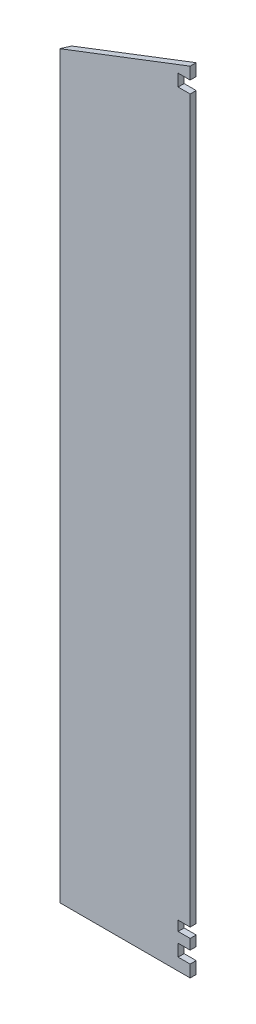
from build123d import *

# Parameters (mm, degrees)
BOSS_EXTRUDE1_DEPTH = 16
CUT_EXTRUDE2_DEPTH  = 2104.387610499
SKETCH6_W           = 32
SKETCH6_H           = 32
SKETCH6_H_2         = 26
CUT_EXTRUDE4_DEPTH  = 1063.402282565


with BuildPart() as part:
    # Sketch1 → Boss-Extrude1 (new body)
    with BuildSketch(Plane.XY):
        Polygon((173, 1048.1), (-173, 915.283043878), (-173, -1048.1), (173, -1048.1), align=None)
    extrude(amount=BOSS_EXTRUDE1_DEPTH)

    # Sketch3 → Cut-Extrude2 (cut, through all)
    with BuildSketch(Plane.XZ.offset(1048.1)):
        Polygon((-173, 16), (-157, 0), (-173, 0), align=None)
    extrude(amount=-CUT_EXTRUDE2_DEPTH, mode=Mode.SUBTRACT)

    # Sketch6 → Cut-Extrude4 (cut, through all)
    with BuildSketch(Plane.XY.offset(16)):
        with Locations((157, 1000.1)):
            Rectangle(SKETCH6_W, SKETCH6_H)
        with Locations((157, -1000.1)):
            Rectangle(SKETCH6_W, SKETCH6_H)
        with Locations((157, -944.1)):
            Rectangle(SKETCH6_W, SKETCH6_H_2)
    extrude(amount=-CUT_EXTRUDE4_DEPTH, mode=Mode.SUBTRACT)


solid = part.part
